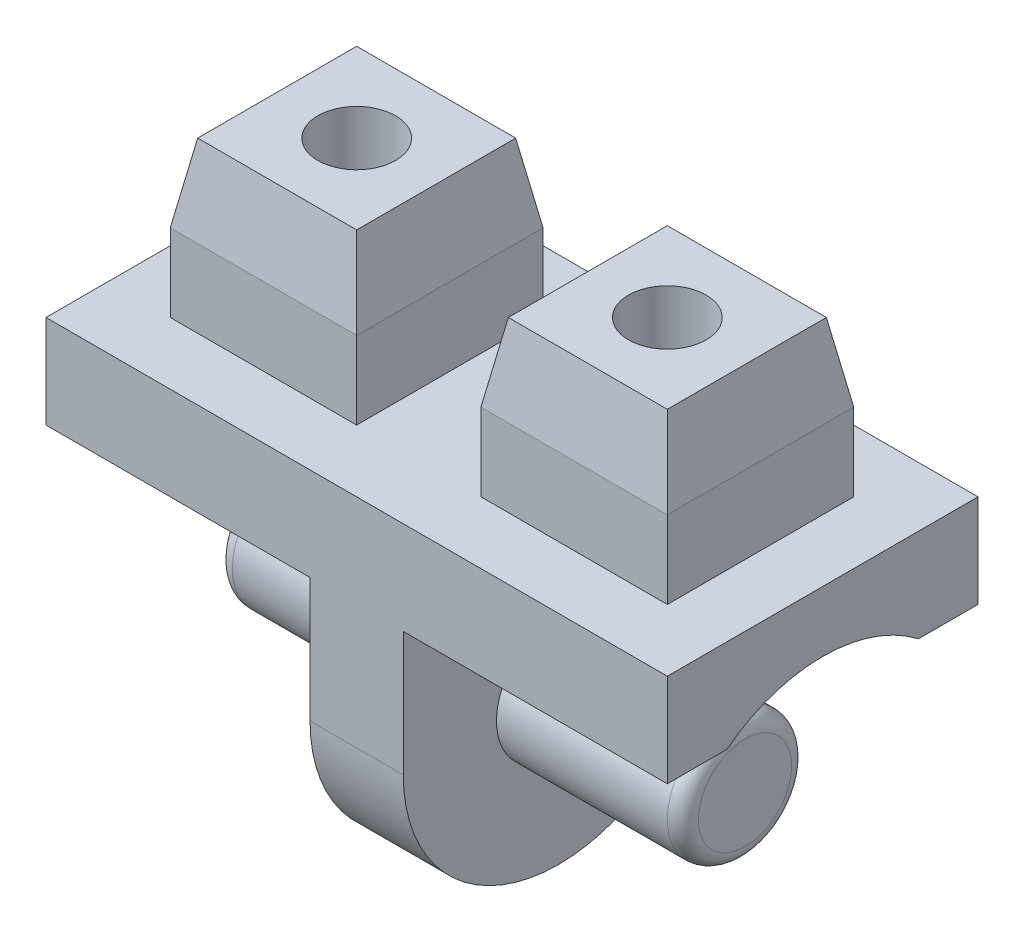
from build123d import *

# Parameters (mm, degrees)
LEG_CONNECTOR_DEPTH                            = 1.5
TORSO_CONNECTOR_DEPTH                          = 8.5
SKETCH3_R                                      = 2
LEG_PIN_DEPTH                                  = 6
SKETCH4_W                                      = 6
SKETCH4_H                                      = 6
TORSO_PIN_BASE_DEPTH                           = 2.5
SKETCH5_W                                      = 6
SKETCH5_H                                      = 6
TORSO_PIN_TIP_DEPTH                            = 2.5
TORSO_PIN_TIP_TAPER                            = 10
HOLE_THAT_MAKE_IT_EASY_TO_ADD_CENTER_LIN_D     = 2.5
HOLE_THAT_MAKE_IT_EASY_TO_ADD_CENTER_LIN_DEPTH = 3.5
HOLE_THAT_MAKE_IT_EASY_TO_ADD_CENTER_LIN_TIP   = 0.751075774
EASY_LEG_INSERT_R                              = 0.5
SCALE1_SCALE                                   = 2


with BuildPart() as part:
    # Sketch1 → Leg connector (new body)
    with BuildSketch(Plane(origin=(0, 0, 0), x_dir=(0, 0, -1), z_dir=(1, 0, 0))):
        with BuildLine():
            Line((-5, 0), (5, 0))
            Line((5, 0), (5, -7))
            ThreePointArc((5, -7), (0, -12), (-5, -7))
            Line((-5, -7), (-5, 0))
        make_face()
    extrude(amount=LEG_CONNECTOR_DEPTH)

    # Sketch2 → Torso connector (add)
    with BuildSketch(Plane(origin=(1.5, 0, 0), x_dir=(0, 0, -1), z_dir=(1, 0, 0))):
        with BuildLine():
            Line((-5, 0), (5, 0))
            Line((5, 0), (5, -3))
            Line((5, -3), (3.082612528, -3))
            ThreePointArc((3.082612528, -3), (0, -1.95), (-3.082612528, -3))
            Line((-3.082612528, -3), (-5, -3))
            Line((-5, -3), (-5, 0))
        make_face()
    extrude(amount=TORSO_CONNECTOR_DEPTH)

    # Sketch3 → Leg pin (add)
    with BuildSketch(Plane(origin=(1.5, 0, 0), x_dir=(0, 0, -1), z_dir=(1, 0, 0))):
        with Locations((0, -7)):
            Circle(SKETCH3_R)
    extrude(amount=LEG_PIN_DEPTH)

    # Sketch4 → Torso pin base (add)
    with BuildSketch(Plane(origin=(0, 0, 0), x_dir=(1, 0, 0), z_dir=(0, 1, 0))):
        with Locations((5, 0)):
            Rectangle(SKETCH4_W, SKETCH4_H)
    extrude(amount=TORSO_PIN_BASE_DEPTH)

    # Sketch5 → Torso pin tip (add)
    with BuildSketch(Plane(origin=(0, 2.5, 0), x_dir=(1, 0, 0), z_dir=(0, 1, 0))):
        with Locations((5, 0)):
            Rectangle(SKETCH5_W, SKETCH5_H)
    extrude(amount=TORSO_PIN_TIP_DEPTH, taper=TORSO_PIN_TIP_TAPER)

    # Hole that make it easy to add center lines
    with Locations(Plane(origin=(0, 5, 0), x_dir=(1, 0, 0), z_dir=(0, 1, 0))):
        with Locations((5, 0)):
            Hole(HOLE_THAT_MAKE_IT_EASY_TO_ADD_CENTER_LIN_D / 2, depth=HOLE_THAT_MAKE_IT_EASY_TO_ADD_CENTER_LIN_DEPTH)
            with Locations((0, 0, -(HOLE_THAT_MAKE_IT_EASY_TO_ADD_CENTER_LIN_DEPTH + HOLE_THAT_MAKE_IT_EASY_TO_ADD_CENTER_LIN_TIP / 2))):  # 118° drill point
                Cone(0, HOLE_THAT_MAKE_IT_EASY_TO_ADD_CENTER_LIN_D / 2, HOLE_THAT_MAKE_IT_EASY_TO_ADD_CENTER_LIN_TIP, mode=Mode.SUBTRACT)

    # Easy leg insert
    easy_leg_insert_edges = [part.edges().sort_by_distance(p)[0] for p in [
        (7.5, -7, 2),
    ]]
    fillet(easy_leg_insert_edges, radius=EASY_LEG_INSERT_R)

    # Making symetrical: part across plane


with BuildPart() as part_1:
    add(part.part)
    add(part.part.mirror(Plane(origin=(0, -7, 0), x_dir=(0, 0, 1), z_dir=(1, 0, 0))))


with BuildPart() as part_2:
    # Scale1: scaled about (0, -2.270029125, 0)
    add(part_1.part.scale(SCALE1_SCALE).moved(Location((0, 2.270029125, 0))))


solid = part_2.part
